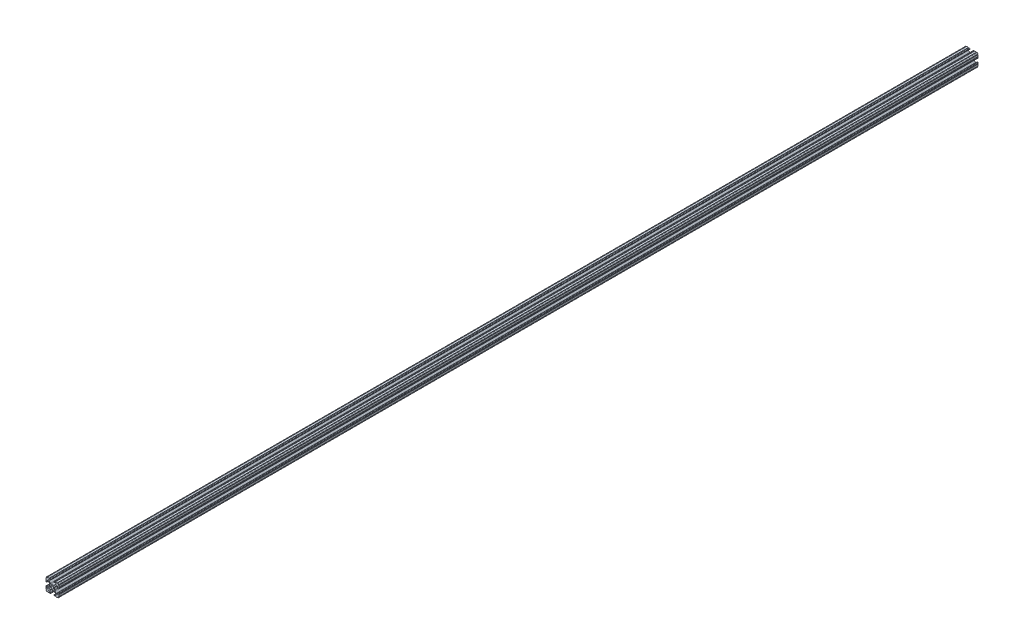
from build123d import *

# Parameters (mm, degrees)
BOSS_EXTRUDE1_DEPTH     = 914.4
CUT_EXTRUDE1_DEPTH      = 915.576371879
CUT_EXTRUDE1_DEPTH_BACK = 915.576371879
SKETCH5_R               = 0.55245


with BuildPart() as part:
    # Sketch4 → Boss-Extrude1 (new, symmetric)
    with BuildSketch(Plane.XY):
        with BuildLine():
            Line((4.190365, -12.7), (10.11729625, -12.7))
            ThreePointArc((10.11729625, -12.7), (11.943543585, -11.943543585), (12.7, -10.11729625))
            Line((12.7, -10.11729625), (12.7, -4.190365))
            ThreePointArc((12.7, -4.190365), (12.42492494, -3.52627506), (11.760835, -3.2512))
            Line((11.760835, -3.2512), (11.429365, -3.2512))
            ThreePointArc((11.429365, -3.2512), (10.76527506, -3.52627506), (10.4902, -4.190365))
            Line((10.4902, -4.190365), (10.4902, -6.348478019))
            ThreePointArc((10.4902, -6.348478019), (9.830707141, -7.335478831), (8.666460301, -7.103895736))
            Line((8.666460301, -7.103895736), (5.299899128, -3.737334563))
            ThreePointArc((5.299899128, -3.737334563), (4.817571085, -3.015479634), (4.6482, -2.16399369))
            Line((4.6482, -2.16399369), (4.6482, 0))
            Line((4.6482, 0), (2.6035, 0))
            ThreePointArc((2.6035, 0), (1.840952505, -1.840952505), (0, -2.6035))
            Line((0, -2.6035), (0, -4.6482))
            Line((0, -4.6482), (2.16399369, -4.6482))
            ThreePointArc((2.16399369, -4.6482), (3.015479634, -4.817571085), (3.737334563, -5.299899128))
            Line((3.737334563, -5.299899128), (7.103895736, -8.666460301))
            ThreePointArc((7.103895736, -8.666460301), (7.335478831, -9.830707141), (6.348478019, -10.4902))
            Line((6.348478019, -10.4902), (4.190365, -10.4902))
            ThreePointArc((4.190365, -10.4902), (3.52627506, -10.76527506), (3.2512, -11.429365))
            Line((3.2512, -11.429365), (3.2512, -11.760835))
            ThreePointArc((3.2512, -11.760835), (3.52627506, -12.42492494), (4.190365, -12.7))
        make_face()
    extrude(amount=BOSS_EXTRUDE1_DEPTH, both=True)

    # Sketch5 → Cut-Extrude1 (cut, two sides: drawn at the far end of the back side and taken through both)
    with BuildSketch(Plane.XY.offset(-CUT_EXTRUDE1_DEPTH_BACK)):
        with Locations((10.356153152, -12.7)):
            Circle(SKETCH5_R)
        with Locations((5.796028019, -12.7)):
            Circle(SKETCH5_R)
        with Locations((12.7, -10.356153152)):
            Circle(SKETCH5_R)
        with Locations((12.7, -5.796028019)):
            Circle(SKETCH5_R)
    extrude(amount=CUT_EXTRUDE1_DEPTH + CUT_EXTRUDE1_DEPTH_BACK, mode=Mode.SUBTRACT)

    # Mirror1: part across plane


with BuildPart() as part_1:
    add(part.part)
    add(part.part.mirror(Plane(origin=(0, 0, 0), x_dir=(0, 0, 1), z_dir=(1, 0, 0))))

    # Mirror2: part across plane


with BuildPart() as part_2:
    add(part_1.part)
    add(part_1.part.mirror(Plane.ZX))


solid = part_2.part
